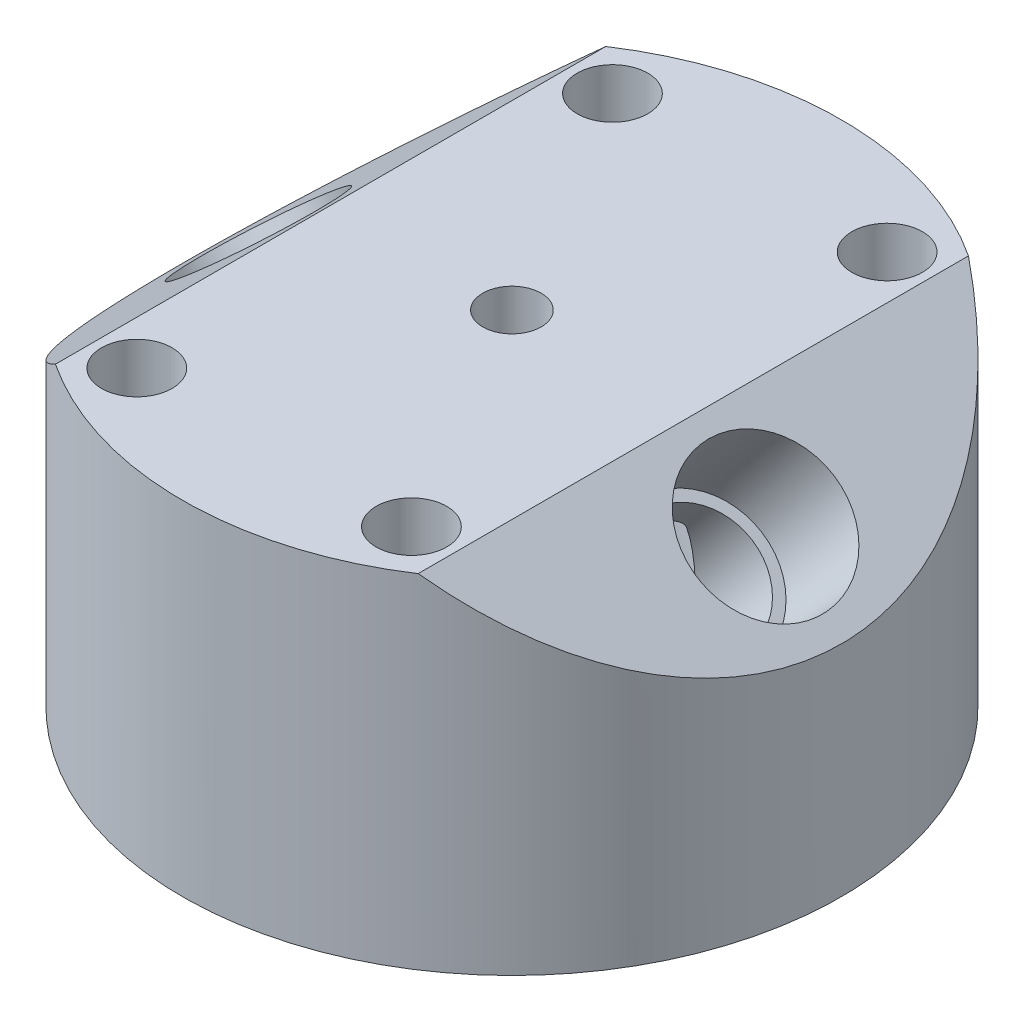
from build123d import *

# Parameters (mm, degrees)
CUT_EXTRUDE1_DEPTH         = 58.529738397
CUT_EXTRUDE1_DEPTH_BACK    = 58.529738397
F_1_4_28_TAPPED_HOLE1_D    = 5.4102
CUT_EXTRUDE2_START         = -6.35
SKETCH5_R                  = 30.48
CUT_EXTRUDE2_DEPTH         = 6.35
USE_ROUND_CORNER_ENDMILL_R = 0.762
F_1_4_CLEARANCE_HOLE1_D    = 6.5278


with BuildPart() as part:
    # MASTER → MASTER_SKETCH (revolve)
    with BuildSketch(Plane.XY):
        Polygon((0, 38.1), (-30.48, 38.1), (-30.48, 0), (-12.7, 0), (-12.7, 19.05), (-6.3246, 19.05), (-4.7625, 17.4879), (0, 17.4879), align=None)
    revolve(axis=Axis((0, 38.1, 0), (0, -1, 0)))

    # Sketch2 → Cut-Extrude1 (cut, two sides: drawn at the far end of the back side and taken through both)
    with BuildSketch(Plane.XY.offset(-CUT_EXTRUDE1_DEPTH_BACK)):
        Polygon((-30.48, 20.248277745), (-9.205145869, 38.1), (-30.48, 38.1), align=None)
        Polygon((30.48, 38.1), (9.205145869, 38.1), (30.48, 20.248277745), align=None)
    extrude(amount=CUT_EXTRUDE1_DEPTH + CUT_EXTRUDE1_DEPTH_BACK, mode=Mode.SUBTRACT)

    # 1/4-28 Tapped Hole1 (through all)
    with Locations(Plane(origin=(0, 38.1, 0), x_dir=(1, 0, 0), z_dir=(0, 1, 0))):
        with Locations((0, 0)):
            Hole(F_1_4_28_TAPPED_HOLE1_D / 2)

    # Sketch5 → Cut-Extrude2 (cut)
    with BuildSketch(Plane(origin=(0, 38.1, 0), x_dir=(1, 0, 0), z_dir=(0, 1, 0)).offset(CUT_EXTRUDE2_START)):
        with Locations(Location((0, 0, 0), (0, 0, 180))):
            Circle(SKETCH5_R)
    extrude(amount=CUT_EXTRUDE2_DEPTH, mode=Mode.SUBTRACT)

    # use-round-corner-endmill
    use_round_corner_endmill_edges = [part.edges().sort_by_distance(p)[0] for p in [
        (6.3246, 19.05, 0),
        (12.7, 19.05, 0),
    ]]
    fillet(use_round_corner_endmill_edges, radius=USE_ROUND_CORNER_ENDMILL_R)

    # Sketch7 → 1/4 NPT Tapped Hole1 (revolve, cut)
    with BuildSketch(Plane(origin=(-23.455832083, 26.142254454, 0), x_dir=(-0.7660444431189741, -0.642787609686544, 0), z_dir=(0, 0, 1))):
        Polygon((0, 0), (0, 54.695413336), (5.5626, 54.695413336), (5.5626, 9.906), (6.557984794, 9.906), (6.8545837, 0), align=None)
    f_1_4_npt_tapped_hole1 = revolve(axis=Axis((-27.537533405, 31.006636667, 0), (0.6427876096865441, -0.7660444431189741, 0)), mode=Mode.SUBTRACT)

    # Mirror1: 1/4 NPT Tapped Hole1 across plane
    add(f_1_4_npt_tapped_hole1.mirror(Plane(origin=(0, 0, 0), x_dir=(0, 0, 1), z_dir=(1, 0, 0))), mode=Mode.SUBTRACT)

    # 1/4 Clearance Hole1 (through all)
    with Locations(Plane(origin=(0, 31.75, 0), x_dir=(1, 0, 0), z_dir=(0, 1, 0))):
        with Locations((-12.7, -21.997045256), (12.7, -21.997045256), (12.7, 21.997045256), (-12.7, 21.997045256)):
            Hole(F_1_4_CLEARANCE_HOLE1_D / 2)


solid = part.part
